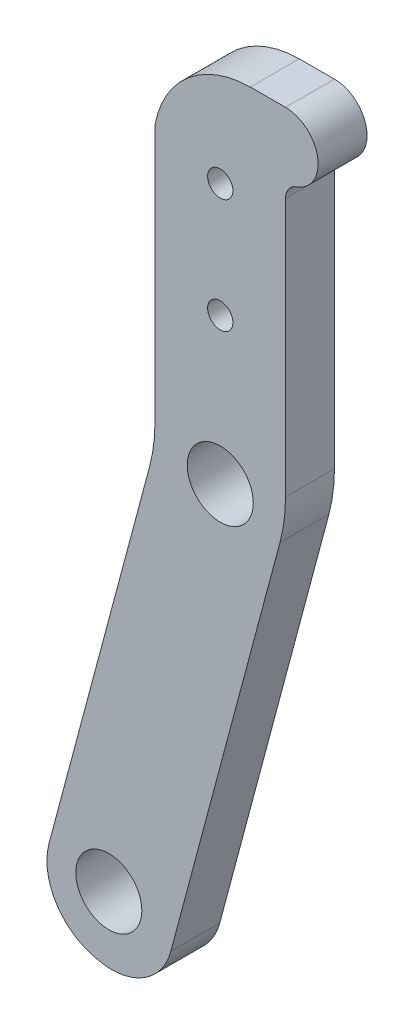
from build123d import *

# Parameters (mm, degrees)
DODANIE_WYCI_GNI_CIE1_DEPTH = 6
SZKIC2_R                    = 4.05
WYTNIJ_WYCI_GNI_CIE1_DEPTH  = 6
SZKIC4_R                    = 4.05
WYTNIJ_WYCI_GNI_CIE4_DEPTH  = 6
WYTNIJ_WYCI_GNI_CIE5_DEPTH  = 6
SZKIC6_R                    = 4
DODANIE_WYCI_GNI_CIE2_DEPTH = 6
SZKIC7_R                    = 1.55
WYTNIJ_WYCI_GNI_CIE6_DEPTH  = 10
DODANIE_WYCI_GNI_CIE3_DEPTH = 6
WYTNIJ_WYCI_GNI_CIE7_DEPTH  = 6


with BuildPart() as part:
    # Szkic1 → Dodanie-wyciągnięcie1 (new body)
    with BuildSketch(Plane.XY):
        with BuildLine():
            Line((183.434880274, 83.617157096), (183.434880274, 42.242261437))
            ThreePointArc((183.434880274, 42.242261437), (183.264795483, 39.639481612), (182.757433993, 37.080971114))
            Line((182.757433993, 37.080971114), (167.434880274, -20.282759431))
            Line((167.434880274, -20.282759431), (152.500436986, -16.293587051))
            Line((152.500436986, -16.293587051), (166.757433993, 37.080971114))
            ThreePointArc((166.757433993, 37.080971114), (167.264795483, 39.639481612), (167.434880274, 42.242261437))
            Line((167.434880274, 42.242261437), (167.434880274, 83.617157096))
            Line((167.434880274, 83.617157096), (183.434880274, 83.617157096))
        make_face()
    extrude(amount=DODANIE_WYCI_GNI_CIE1_DEPTH)

    # Szkic2 → Wytnij-wyciągnięcie1 (cut)
    with BuildSketch(Plane.XY.offset(6)):
        with Locations((175.434880274, 39.617157096)):
            Circle(SZKIC2_R)
        with Locations((175.434880274, -14.382842904)):
            Circle(SZKIC2_R)
    extrude(amount=-WYTNIJ_WYCI_GNI_CIE1_DEPTH, mode=Mode.SUBTRACT)

    # Szkic4 → Wytnij-wyciągnięcie4 (cut)
    with BuildSketch(Plane.XY.offset(6)):
        with Locations((161.770374916, -10.489221815)):
            Circle(SZKIC4_R)
    extrude(amount=-WYTNIJ_WYCI_GNI_CIE4_DEPTH, mode=Mode.SUBTRACT)

    # Szkic5 → Wytnij-wyciągnięcie5 (cut)
    with BuildSketch(Plane.XY.offset(6)):
        with BuildLine():
            Line((167.434880274, 73.777889147), (167.434880274, 83.617157096))
            Line((167.434880274, 83.617157096), (179.126801066, 83.617157096))
            ThreePointArc((179.126801066, 83.617157096), (171.51222692, 80.799152225), (167.434880274, 73.777889147))
        make_face()
    extrude(amount=-WYTNIJ_WYCI_GNI_CIE5_DEPTH, mode=Mode.SUBTRACT)

    # Szkic6 → Dodanie-wyciągnięcie2 (add)
    with BuildSketch(Plane.XY.offset(6)):
        with Locations((183.434880274, 79.617157096)):
            Circle(SZKIC6_R)
    extrude(amount=-DODANIE_WYCI_GNI_CIE2_DEPTH)

    # Szkic7 → Wytnij-wyciągnięcie6 (cut)
    with BuildSketch(Plane.XY.offset(6)):
        with Locations((175.434880274, 57.530770571)):
            Circle(SZKIC7_R)
        with Locations((175.434880274, 71.530770571)):
            Circle(SZKIC7_R)
    extrude(amount=-WYTNIJ_WYCI_GNI_CIE6_DEPTH, mode=Mode.SUBTRACT)

    # Szkic8 → Dodanie-wyciągnięcie3 (add)
    with BuildSketch(Plane.XY.offset(6)):
        with BuildLine():
            Line((184.768213607, 75.84592093), (183.01913403, 76.038564372))
            Line((183.01913403, 76.038564372), (183.434880274, 73.960302847))
            ThreePointArc((183.434880274, 73.960302847), (183.801887112, 75.115003385), (184.768213607, 75.84592093))
        make_face()
    extrude(amount=-DODANIE_WYCI_GNI_CIE3_DEPTH)

    # Szkic10 → Wytnij-wyciągnięcie7 (cut)
    with BuildSketch(Plane.XY.offset(6)):
        with BuildLine():
            Line((169.370364145, -13.036801787), (167.434880274, -20.282759431))
            Line((167.434880274, -20.282759431), (160.18892263, -18.34727556))
            ThreePointArc((160.18892263, -18.34727556), (165.879478517, -17.593577473), (169.370364145, -13.036801787))
        make_face()
        with BuildLine():
            Line((154.435920857, -9.047629406), (152.500436986, -16.293587051))
            Line((152.500436986, -16.293587051), (159.74639463, -18.229070922))
            ThreePointArc((159.74639463, -18.229070922), (155.189618945, -14.738185294), (154.435920857, -9.047629406))
        make_face()
    extrude(amount=-WYTNIJ_WYCI_GNI_CIE7_DEPTH, mode=Mode.SUBTRACT)


solid = part.part
